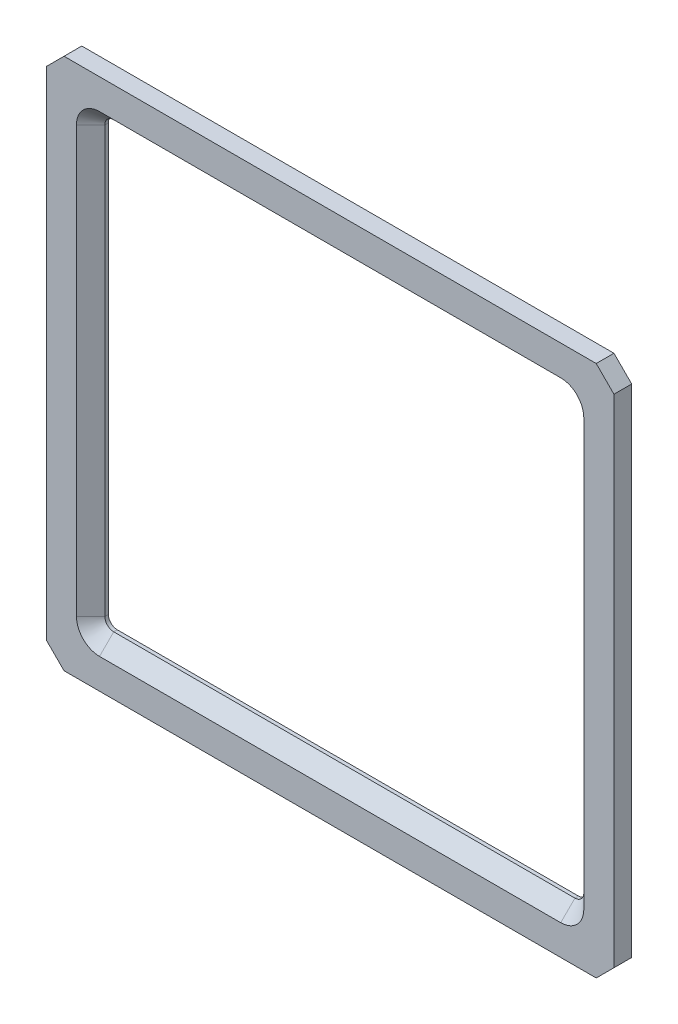
from build123d import *

# Parameters (mm, degrees)
SKETCH_1_W          = 320
SKETCH_1_H          = 300
EXTRUDE_1_DEPTH     = 10
CHAMFER_1_SIZE      = 10
CUT_EXTRUDE_1_REACH = 221.545
CHAMFER_2_SIZE      = 8


with BuildPart() as part:
    # 草图1 → 凸台-拉伸1 (new body)
    with BuildSketch(Plane.XY):
        Rectangle(SKETCH_1_W, SKETCH_1_H)
    extrude(amount=EXTRUDE_1_DEPTH)

    # 倒角1
    chamfer_1_edges = [part.edges().sort_by_distance(p)[0] for p in [
        (160, -150, 5),
        (-160, -150, 5),
        (-160, 150, 5),
        (160, 150, 5),
    ]]
    chamfer(chamfer_1_edges, length=CHAMFER_1_SIZE)

    # 草图2 → 切除-拉伸1 (cut, up to next)
    with BuildSketch(Plane.XY.offset(10), mode=Mode.PRIVATE) as cut_extrude_1_sk1:
        with BuildLine():
            Line((-130, 125), (130, 125))
            ThreePointArc((130, 125), (133.535533906, 123.535533906), (135, 120))
            Line((135, 120), (135, -120))
            ThreePointArc((135, -120), (133.535533906, -123.535533906), (130, -125))
            Line((130, -125), (-130, -125))
            ThreePointArc((-130, -125), (-133.535533906, -123.535533906), (-135, -120))
            Line((-135, -120), (-135, 120))
            ThreePointArc((-135, 120), (-133.535533906, 123.535533906), (-130, 125))
        make_face()
    cut_extrude_1_tool1 = extrude(cut_extrude_1_sk1.sketch, amount=-CUT_EXTRUDE_1_REACH, mode=Mode.PRIVATE) & part.part
    add(cut_extrude_1_tool1.solids().sort_by_distance((0, 0, 10))[0], mode=Mode.SUBTRACT)

    # 倒角2
    chamfer_2_edges = [part.edges().sort_by_distance(p)[0] for p in [
        (-133.535533906, -123.535533906, 10),
        (0, -125, 10),
        (133.535533906, -123.535533906, 10),
        (135, 0, 10),
        (133.535533906, 123.535533906, 10),
        (0, 125, 10),
        (-133.535533906, 123.535533906, 10),
        (-135, 0, 10),
    ]]
    chamfer(chamfer_2_edges, length=CHAMFER_2_SIZE)


solid = part.part
